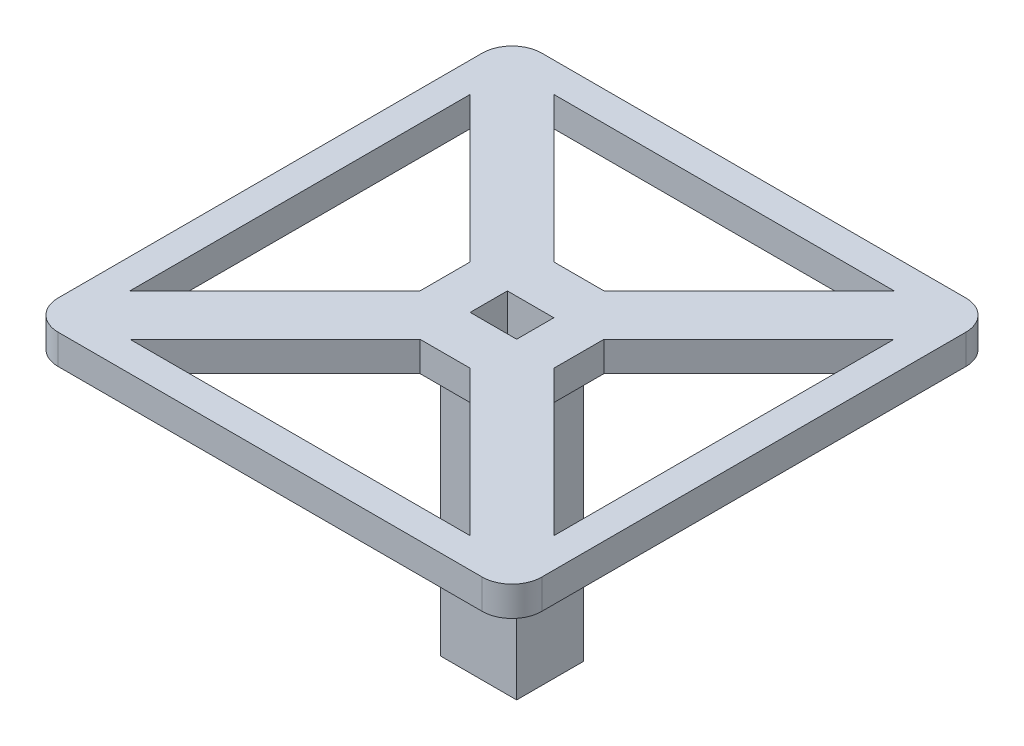
from build123d import *

# Parameters (mm, degrees)
SKETCH1_W           = 6.50875
SKETCH1_H           = 5.715
SKETCH1_W_2         = 3.96875
SKETCH1_H_2         = 3.175
BOSS_EXTRUDE1_DEPTH = 25.4
SKETCH2_W           = 41.275
SKETCH2_H           = 41.275
SKETCH2_W_2         = 6.50875
SKETCH2_H_2         = 5.715
BOSS_EXTRUDE2_DEPTH = 2.54
CUT_EXTRUDE1_DEPTH  = 39.690732902
FILLET1_R           = 2.54


with BuildPart() as part:
    # Sketch1 → Boss-Extrude1 (new body)
    with BuildSketch(Plane(origin=(0, 0, 0), x_dir=(1, 0, 0), z_dir=(0, 1, 0))):
        Rectangle(SKETCH1_W, SKETCH1_H)
        Rectangle(SKETCH1_W_2, SKETCH1_H_2, mode=Mode.SUBTRACT)
    extrude(amount=BOSS_EXTRUDE1_DEPTH)

    # Sketch2 → Boss-Extrude2 (add)
    with BuildSketch(Plane(origin=(0, 25.4, 0), x_dir=(1, 0, 0), z_dir=(0, 1, 0))):
        Rectangle(SKETCH2_W, SKETCH2_H)
        Rectangle(SKETCH2_W_2, SKETCH2_H_2, mode=Mode.SUBTRACT)
    extrude(amount=-BOSS_EXTRUDE2_DEPTH)

    # Sketch3 → Cut-Extrude1 (cut, through all)
    with BuildSketch(Plane(origin=(0, 25.4, 0), x_dir=(1, 0, 0), z_dir=(0, 1, 0))):
        Polygon((-2.122897552, 5.715), (-14.505397552, 18.0975), (14.505397552, 18.0975), (2.122897552, 5.715), align=None)
        Polygon((-5.715, 2.122897552), (-18.0975, 14.505397552), (-18.0975, -14.505397552), (-5.715, -2.122897552), align=None)
        Polygon((-14.505397552, -18.0975), (-2.122897552, -5.715), (2.122897552, -5.715), (14.505397552, -18.0975), align=None)
        Polygon((18.0975, 14.505397552), (5.715, 2.122897552), (5.715, -2.122897552), (18.0975, -14.505397552), align=None)
    extrude(amount=-CUT_EXTRUDE1_DEPTH, mode=Mode.SUBTRACT)

    # Fillet1
    fillet1_edges = [part.edges().sort_by_distance(p)[0] for p in [
        (20.6375, 24.13, -20.6375),
        (20.6375, 24.13, 20.6375),
        (-20.6375, 24.13, 20.6375),
        (-20.6375, 24.13, -20.6375),
    ]]
    fillet(fillet1_edges, radius=FILLET1_R)


solid = part.part
